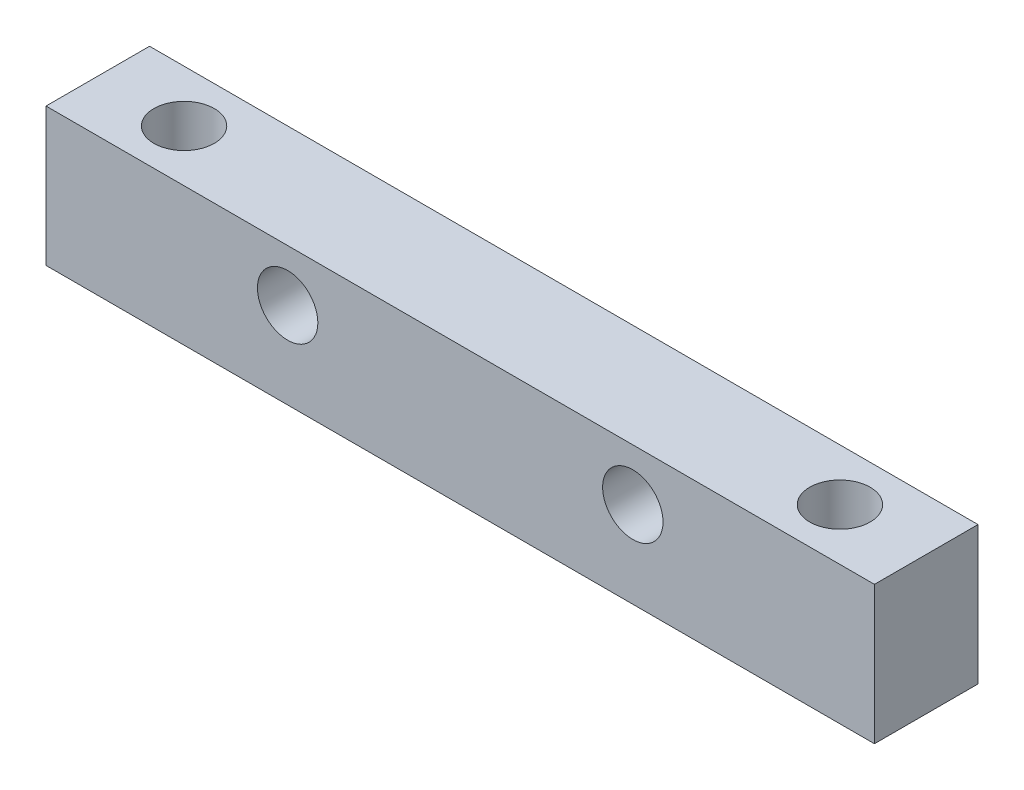
from build123d import *

# Parameters (mm, degrees)
SKETCH_1_W          = 48
SKETCH_1_H          = 6
SKETCH_1_R          = 1.75
EXTRUDE_1_DEPTH     = 8
SKETCH_2_R          = 1.75
CUT_EXTRUDE_1_DEPTH = 45.147480109


with BuildPart() as part:
    # 草图1 → 凸台-拉伸1 (new body)
    with BuildSketch(Plane(origin=(0, 0, 0), x_dir=(1, 0, 0), z_dir=(0, 1, 0))):
        with Locations((19, 0)):
            Rectangle(SKETCH_1_W, SKETCH_1_H)
        with Locations(Location((0, 0, 0), (0, 0, 270))):
            Circle(SKETCH_1_R, mode=Mode.SUBTRACT)
        with Locations(Location((38, 0, 0), (0, 0, 270))):
            Circle(SKETCH_1_R, mode=Mode.SUBTRACT)
    extrude(amount=EXTRUDE_1_DEPTH)

    # 草图2 → 切除-拉伸1 (cut, through all)
    with BuildSketch(Plane.XY.offset(3)):
        with Locations((9, 5)):
            Circle(SKETCH_2_R)
        with Locations((29, 5)):
            Circle(SKETCH_2_R)
    extrude(amount=-CUT_EXTRUDE_1_DEPTH, mode=Mode.SUBTRACT)


solid = part.part
